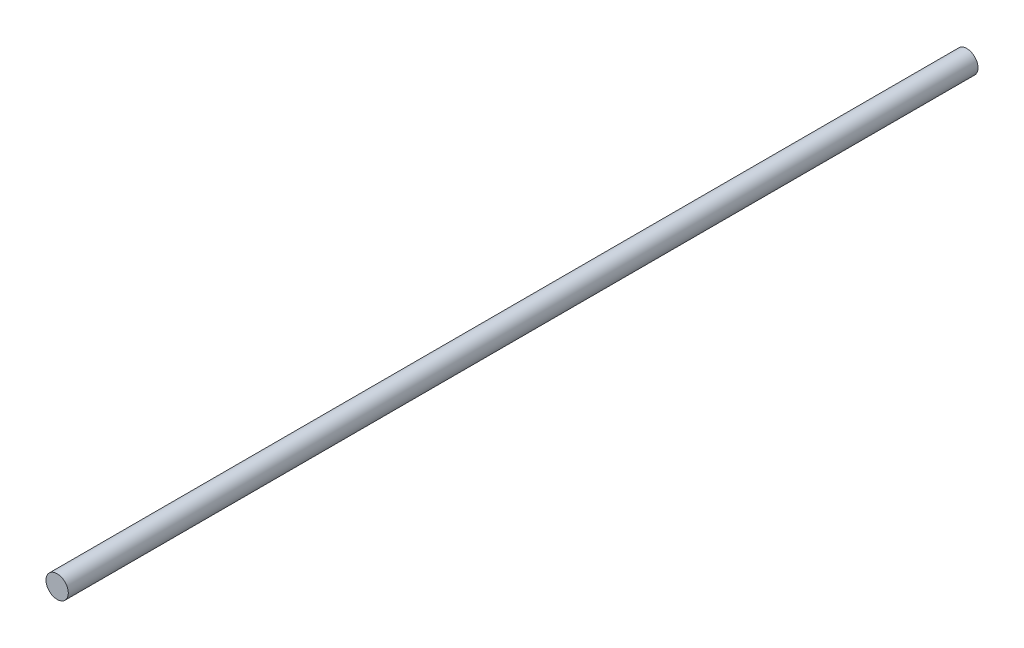
from build123d import *

# Parameters (mm, degrees)
CROQUIS1_R              = 4
SALIENTE_EXTRUIR1_DEPTH = 326


with BuildPart() as part:
    # Croquis1 → Saliente-Extruir1 (new body)
    with BuildSketch(Plane.XY):
        Circle(CROQUIS1_R)
    extrude(amount=SALIENTE_EXTRUIR1_DEPTH)


solid = part.part
